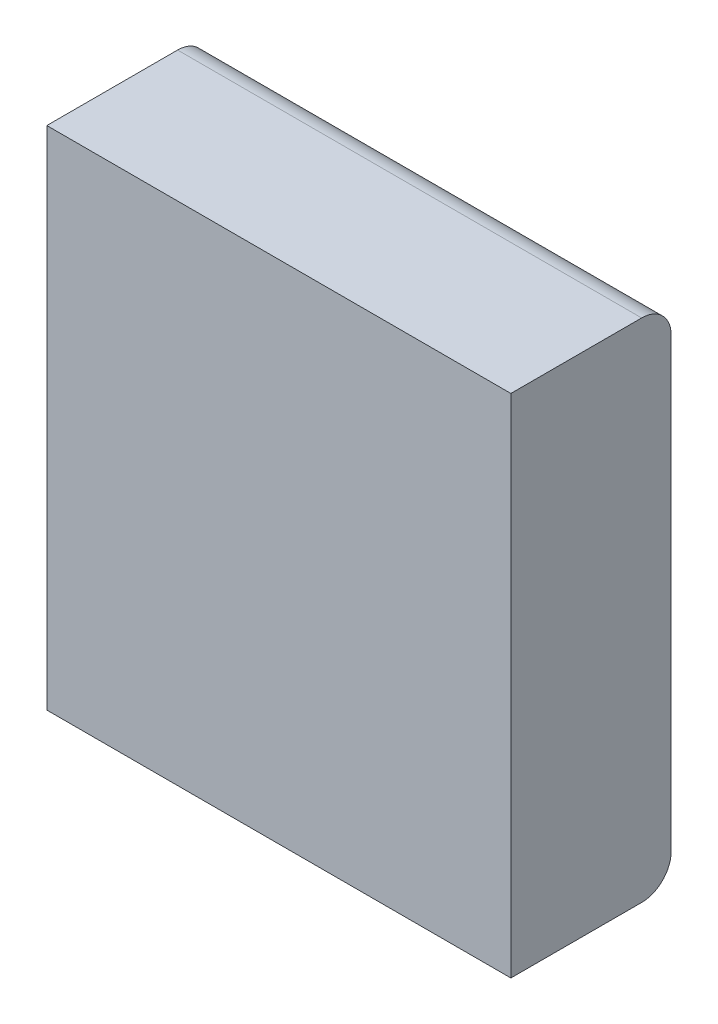
from build123d import *

# Parameters (mm, degrees)
SKETCH_1_W          = 110
SKETCH_1_H          = 120
EXTRUDE_1_DEPTH     = 30
EXTRUDE_2_DEPTH     = 110
SKETCH_3_W          = 40
SKETCH_3_H          = 60
CUT_EXTRUDE_1_DEPTH = 3


with BuildPart() as part:
    # 스케치1 → 보스-돌출1 (new body)
    with BuildSketch(Plane.XY):
        with Locations((-9.053023491, -24.839285714)):
            Rectangle(SKETCH_1_W, SKETCH_1_H)
    extrude(amount=EXTRUDE_1_DEPTH)

    # 스케치2 → 보스-돌출2 (add)
    with BuildSketch(Plane(origin=(45.946976509, 0, 0), x_dir=(0, 0, -1), z_dir=(1, 0, 0))):
        with BuildLine():
            Line((0, 35.160714286), (1, 35.160714286))
            ThreePointArc((1, 35.160714286), (5.949747468, 33.110461754), (8, 28.160714286))
            Line((8, 28.160714286), (8, -77.839285714))
            ThreePointArc((8, -77.839285714), (5.949747468, -82.789033183), (1, -84.839285714))
            Line((1, -84.839285714), (0, -84.839285714))
            Line((0, -84.839285714), (0, 35.160714286))
        make_face()
    extrude(amount=-EXTRUDE_2_DEPTH)

    # 스케치3 → 컷-돌출1 (cut)
    with BuildSketch(Plane(origin=(0, 0, -8), x_dir=(-1, 0, 0), z_dir=(0, 0, -1))):
        with Locations((-15.946976509, -24.839285714)):
            Rectangle(SKETCH_3_W, SKETCH_3_H)
    extrude(amount=-CUT_EXTRUDE_1_DEPTH, mode=Mode.SUBTRACT)


solid = part.part
